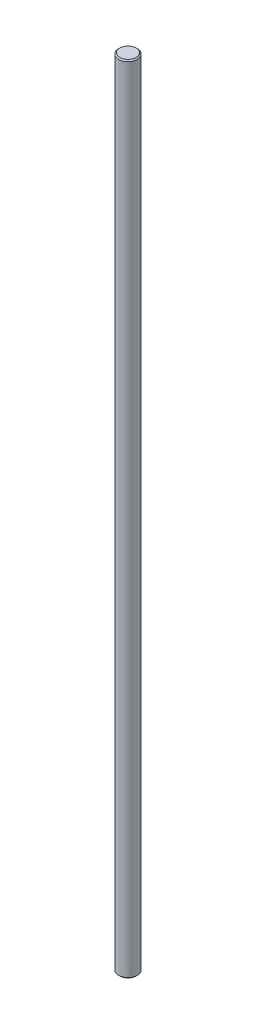
from build123d import *

# Parameters (mm, degrees)
SKETCH1_R      = 4
EXTRUDE1_DEPTH = 340
CHAMFER1_SIZE  = 0.5


with BuildPart() as part:
    # Sketch1 → Extrude1 (new body)
    with BuildSketch(Plane(origin=(0, 0, 0), x_dir=(1, 0, 0), z_dir=(0, 1, 0))):
        with Locations(Location((0, 0, 0), (0, 0, 270))):
            Circle(SKETCH1_R)
    extrude(amount=EXTRUDE1_DEPTH)

    # Chamfer1
    chamfer1_edges = [part.edges().sort_by_distance(p)[0] for p in [
        (0, 0, -4),
        (0, 340, -4),
    ]]
    chamfer(chamfer1_edges, length=CHAMFER1_SIZE)


solid = part.part
